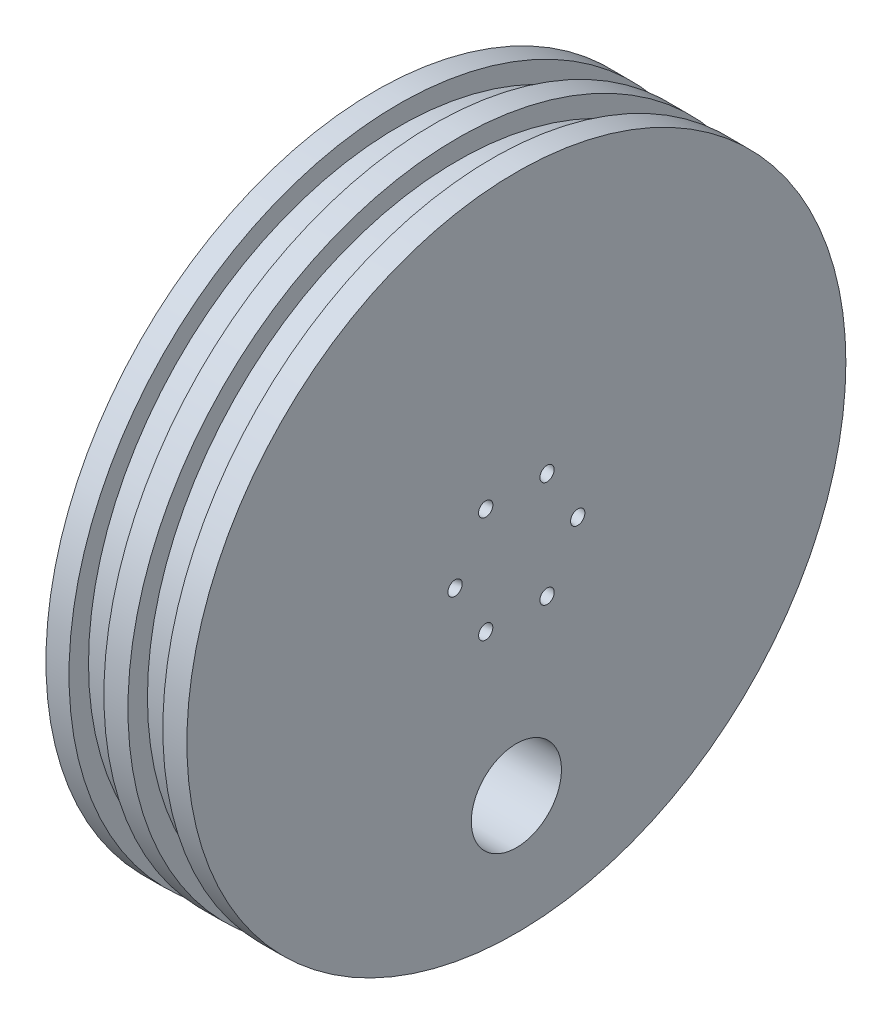
from build123d import *

# Parameters (mm, degrees)
CIRPATTERN2_COUNT                = 3
CIRPATTERN1_COUNT                = 6
F_8_32_TAPPED_HOLE1_D            = 3.4544
F_8_32_TAPPED_HOLE1_DEPTH        = 6.35
F_8_32_TAPPED_HOLE1_TIP          = 1.037806461
F_50_0_07_DIAMETER_HOLE1_D       = 1.778
F_50_0_07_DIAMETER_HOLE1_DEPTH   = 11.938
F_50_0_07_DIAMETER_HOLE1_TIP     = 0.53416509
Q_0_332_DIAMETER_HOLE1_D         = 8.4328
F_3_8_0_375_DIAMETER_HOLE1_D     = 9.525
F_3_8_0_375_DIAMETER_HOLE1_DEPTH = 9.144
F_3_8_0_375_DIAMETER_HOLE1_TIP   = 2.861598698


with BuildPart() as part:
    # Sketch1 → Revolve1 (revolve)
    with BuildSketch(Plane.XY):
        Polygon((-12.599, 0), (0, 0), (0, 34.798), (-2.54, 34.798), (-2.54, 32.7406), (-6.223, 32.7406), (-6.223, 34.798), (-8.763, 34.798), (-8.763, 32.7406), (-12.446, 32.7406), (-12.446, 34.798), (-14.885, 34.798), (-14.885, 29.1592), (-18.06, 29.1592), (-18.06, 4.7625), (-12.599, 4.7625), align=None)
    revolve(axis=Axis((17.779879847, 0, 0), (-1, 0, 0)))

    # Sketch24 → #20 (0.161) Diameter Hole1 (revolve, cut)
    with BuildSketch(Plane(origin=(-18.06, 22.225, 0), x_dir=(0, 0, 1), z_dir=(0, 1, 0))):
        Polygon((0, 0), (0, 10.880579708), (2.0447, 9.652), (2.0447, 0), align=None)
    f_20_0_161_diameter_hole1 = revolve(axis=Axis((-24.41, 22.225, 0), (1, 0, 0)), mode=Mode.SUBTRACT)

    # CirPattern2: #20 (0.161) Diameter Hole1 ×3 about axis
    cirpattern2_axis = Axis((17.779879847, 0, 0), (1, 0, 0))
    for i in range(1, CIRPATTERN2_COUNT):
        add(f_20_0_161_diameter_hole1.rotate(cirpattern2_axis, i * 360 / CIRPATTERN2_COUNT), mode=Mode.SUBTRACT)

    # Sketch19 → Ø1.5 (1.5) Diameter Hole4 (revolve, cut)
    with BuildSketch(Plane(origin=(0.866676253, -0.068634017, -6.358122396), x_dir=(0.15097729062415485, 0.7033639629103843, -0.6946113973977026), z_dir=(-0.040958510327058266, 0.7065134112073841, 0.7065134112073841))):
        Polygon((0, 0), (0, 24.51962842), (0.75, 24.068982956), (0.75, 0), align=None)
    f_1_5_1_5_diameter_hole4 = revolve(axis=Axis((7.138497216, -0.565313443, -5.497848394), (-0.9876883405951382, 0.07821723252011407, -0.13547622075226584)), mode=Mode.SUBTRACT)

    # CirPattern1: Ø1.5 (1.5) Diameter Hole4 ×6 about axis
    cirpattern1_axis = Axis((-26.67, 0, 0), (1, 0, 0))
    for i in range(1, CIRPATTERN1_COUNT):
        add(f_1_5_1_5_diameter_hole4.rotate(cirpattern1_axis, i * 360 / CIRPATTERN1_COUNT), mode=Mode.SUBTRACT)

    # #8-32 Tapped Hole1
    with Locations(Plane.ZY.offset(12.599)):
        with Locations((0, 0)):
            Hole(F_8_32_TAPPED_HOLE1_D / 2, depth=F_8_32_TAPPED_HOLE1_DEPTH)
            with Locations((0, 0, -(F_8_32_TAPPED_HOLE1_DEPTH + F_8_32_TAPPED_HOLE1_TIP / 2))):  # 118° drill point
                Cone(0, F_8_32_TAPPED_HOLE1_D / 2, F_8_32_TAPPED_HOLE1_TIP, mode=Mode.SUBTRACT)

    # #50 (0.07) Diameter Hole1
    with Locations(Plane.ZY.offset(18.06)):
        with Locations((19.632362891, 11.33475)):
            Hole(F_50_0_07_DIAMETER_HOLE1_D / 2, depth=F_50_0_07_DIAMETER_HOLE1_DEPTH)
            with Locations((0, 0, -(F_50_0_07_DIAMETER_HOLE1_DEPTH + F_50_0_07_DIAMETER_HOLE1_TIP / 2))):  # 118° drill point
                Cone(0, F_50_0_07_DIAMETER_HOLE1_D / 2, F_50_0_07_DIAMETER_HOLE1_TIP, mode=Mode.SUBTRACT)

    # Q (0.332) Diameter Hole1 (through all)
    with Locations(Plane.ZY.offset(18.06)):
        with Locations((0, -22.225)):
            Hole(Q_0_332_DIAMETER_HOLE1_D / 2)

    # 3/8 (0.375) Diameter Hole1
    with Locations(Plane(origin=(0, 0, 0), x_dir=(0, 0, -1), z_dir=(1, 0, 0))):
        with Locations((0, -22.225)):
            Hole(F_3_8_0_375_DIAMETER_HOLE1_D / 2, depth=F_3_8_0_375_DIAMETER_HOLE1_DEPTH)
            with Locations((0, 0, -(F_3_8_0_375_DIAMETER_HOLE1_DEPTH + F_3_8_0_375_DIAMETER_HOLE1_TIP / 2))):  # 118° drill point
                Cone(0, F_3_8_0_375_DIAMETER_HOLE1_D / 2, F_3_8_0_375_DIAMETER_HOLE1_TIP, mode=Mode.SUBTRACT)


solid = part.part
